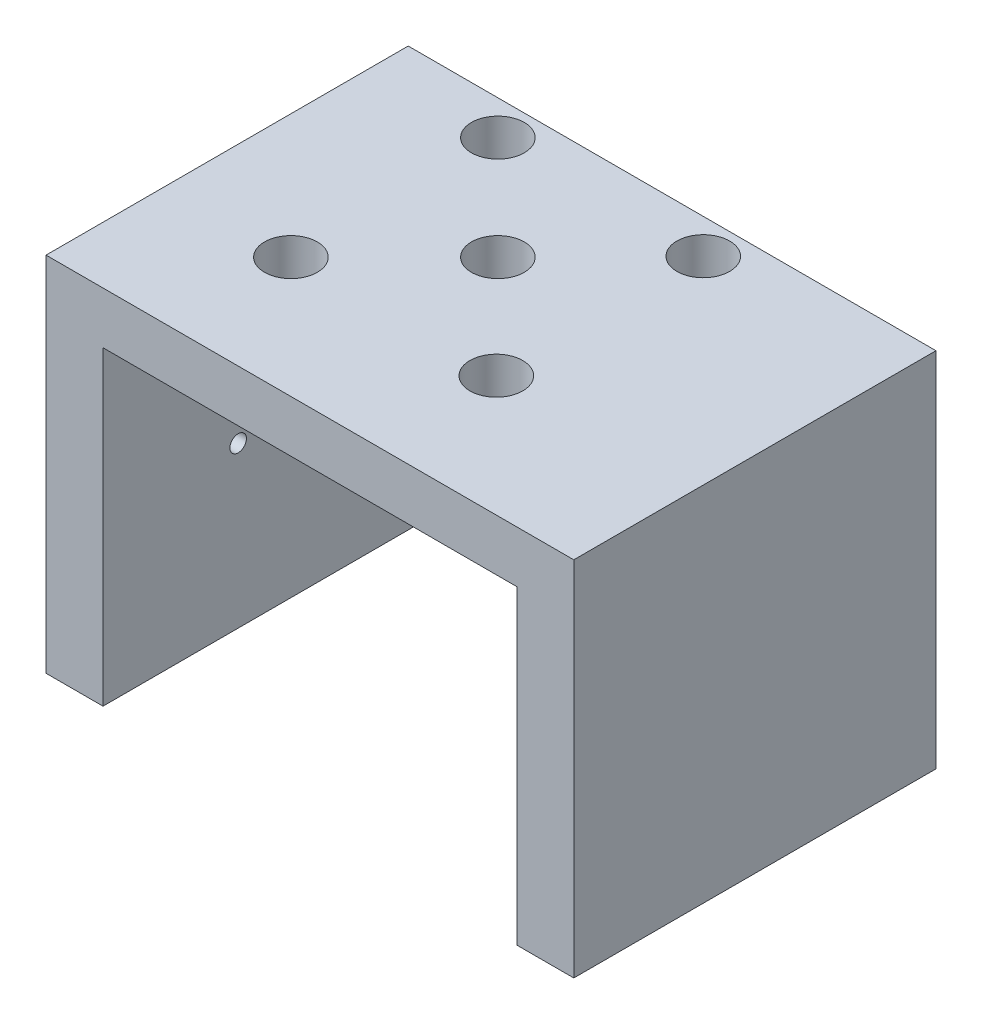
from build123d import *

# Parameters (mm, degrees)
BOSS_EXTRUDE1_DEPTH = 35
SKETCH2_R           = 0.8
CUT_EXTRUDE1_DEPTH  = 6
SKETCH3_R           = 2.55
CUT_EXTRUDE2_DEPTH  = 6


with BuildPart() as part:
    # Sketch1 → Boss-Extrude1 (new body)
    with BuildSketch(Plane.XY):
        Polygon((-45.495099545, 30), (-5.495099545, 30), (-5.495099545, 0), (0, 0), (0, 35), (-51, 35), (-51, 0), (-45.495099545, 0), align=None)
    extrude(amount=-BOSS_EXTRUDE1_DEPTH)

    # Sketch2 → Cut-Extrude1 (cut)
    with BuildSketch(Plane.ZY.offset(51)):
        with Locations((-13.063320716, 15.474711623)):
            Circle(SKETCH2_R)
        with Locations((-22.063320716, 15.474711623)):
            Circle(SKETCH2_R)
    extrude(amount=-CUT_EXTRUDE1_DEPTH, mode=Mode.SUBTRACT)

    # Sketch3 → Cut-Extrude2 (cut)
    with BuildSketch(Plane(origin=(0, 35, 0), x_dir=(1, 0, 0), z_dir=(0, 1, 0))):
        with Locations(Location((-39, 31.663775096, 0), (0, 0, 180))):
            Circle(SKETCH3_R)
        with Locations(Location((-39, 11.663775096, 0), (0, 0, 180))):
            Circle(SKETCH3_R)
        with Locations(Location((-19.15, 31.663775096, 0), (0, 0, 180))):
            Circle(SKETCH3_R)
        with Locations(Location((-19.15, 11.663775096, 0), (0, 0, 180))):
            Circle(SKETCH3_R)
        with Locations(Location((-29, 21.663775096, 0), (0, 0, 180))):
            Circle(SKETCH3_R)
    extrude(amount=-CUT_EXTRUDE2_DEPTH, mode=Mode.SUBTRACT)


solid = part.part
